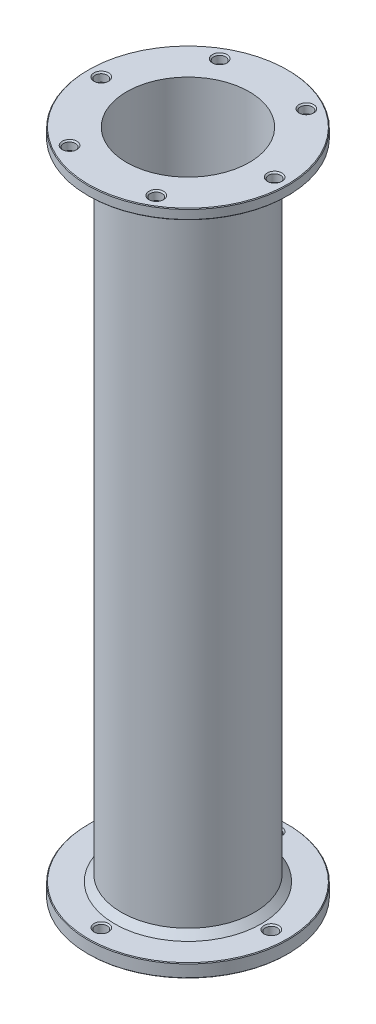
from build123d import *

# Parameters (mm, degrees)
SKIZZE1_R                       = 150
SKIZZE1_R_2                     = 92
SKIZZE1_R_3                     = 9
AUFSATZ_LINEAR_AUSTRAGEN1_DEPTH = 20
SKIZZE2_R                       = 100
SKIZZE2_R_2                     = 92
AUFSATZ_LINEAR_AUSTRAGEN2_DEPTH = 965
SKIZZE3_R                       = 150
SKIZZE3_R_2                     = 92
SKIZZE3_R_3                     = 9
AUFSATZ_LINEAR_AUSTRAGEN3_DEPTH = 15
FASE1_SIZE                      = 10
FASE2_SIZE                      = 1
FASE3_SIZE                      = 2


with BuildPart() as part:
    # Skizze1 → Aufsatz-Linear austragen1 (new body)
    with BuildSketch(Plane(origin=(0, 0, 0), x_dir=(1, 0, 0), z_dir=(0, 1, 0))):
        with Locations(Location((0, 0, 0), (0, 0, 270))):
            Circle(SKIZZE1_R)
        with Locations(Location((0, 0, 0), (0, 0, 270))):
            Circle(SKIZZE1_R_2, mode=Mode.SUBTRACT)
        with Locations(Location((0, 130, 0), (0, 0, 270))):
            Circle(SKIZZE1_R_3, mode=Mode.SUBTRACT)
        with Locations(Location((125, 0, 0), (0, 0, 270))):
            Circle(SKIZZE1_R_3, mode=Mode.SUBTRACT)
        with Locations(Location((-5, -125, 0), (0, 0, 270))):
            Circle(SKIZZE1_R_3, mode=Mode.SUBTRACT)
        with Locations(Location((-130, 5, 0), (0, 0, 270))):
            Circle(SKIZZE1_R_3, mode=Mode.SUBTRACT)
    extrude(amount=AUFSATZ_LINEAR_AUSTRAGEN1_DEPTH)

    # Skizze2 → Aufsatz-Linear austragen2 (add)
    with BuildSketch(Plane(origin=(0, 20, 0), x_dir=(1, 0, 0), z_dir=(0, 1, 0))):
        with Locations(Location((0, 0, 0), (0, 0, 270))):
            Circle(SKIZZE2_R)
        with Locations(Location((0, 0, 0), (0, 0, 270))):
            Circle(SKIZZE2_R_2, mode=Mode.SUBTRACT)
    extrude(amount=AUFSATZ_LINEAR_AUSTRAGEN2_DEPTH)

    # Skizze3 → Aufsatz-Linear austragen3 (add)
    with BuildSketch(Plane(origin=(0, 985, 0), x_dir=(1, 0, 0), z_dir=(0, 1, 0))):
        with Locations(Location((0, 0, 0), (0, 0, 270))):
            Circle(SKIZZE3_R)
        with Locations(Location((0, 0, 0), (0, 0, 270))):
            Circle(SKIZZE3_R_2, mode=Mode.SUBTRACT)
        with Locations(Location((130, 0, 0), (0, 0, 270))):
            Circle(SKIZZE3_R_3, mode=Mode.SUBTRACT)
        with Locations(Location((65, -112.583302492, 0), (0, 0, 270))):
            Circle(SKIZZE3_R_3, mode=Mode.SUBTRACT)
        with Locations(Location((-65, -112.583302492, 0), (0, 0, 270))):
            Circle(SKIZZE3_R_3, mode=Mode.SUBTRACT)
        with Locations(Location((-130, 0, 0), (0, 0, 270))):
            Circle(SKIZZE3_R_3, mode=Mode.SUBTRACT)
        with Locations(Location((-65, 112.583302492, 0), (0, 0, 270))):
            Circle(SKIZZE3_R_3, mode=Mode.SUBTRACT)
        with Locations(Location((65, 112.583302492, 0), (0, 0, 270))):
            Circle(SKIZZE3_R_3, mode=Mode.SUBTRACT)
    extrude(amount=AUFSATZ_LINEAR_AUSTRAGEN3_DEPTH)

    # Fase1
    fase1_edges = [part.edges().sort_by_distance(p)[0] for p in [
        (0, 985, -100),
        (0, 20, -100),
    ]]
    chamfer(fase1_edges, length=FASE1_SIZE)

    # Fase2
    fase2_edges = [part.edges().sort_by_distance(p)[0] for p in [
        (0, 0, -150),
        (0, 1000, -150),
        (0, 985, -150),
        (0, 20, -150),
    ]]
    chamfer(fase2_edges, length=FASE2_SIZE)

    # Fase3
    fase3_edges = [part.edges().sort_by_distance(p)[0] for p in [
        (125, 0, -9),
        (125, 20, -9),
        (-5, 0, 116),
        (-5, 20, 116),
        (-130, 0, -14),
        (-130, 20, -14),
        (130, 985, -9),
        (65, 985, 103.583302492),
        (-65, 985, 103.583302492),
        (-130, 985, -9),
        (-65, 985, -121.583302492),
        (65, 985, -121.583302492),
        (130, 1000, -9),
        (65, 1000, 103.583302492),
        (-65, 1000, 103.583302492),
        (-130, 1000, -9),
        (-65, 1000, -121.583302492),
        (65, 1000, -121.583302492),
        (0, 0, -139),
        (0, 20, -139),
    ]]
    chamfer(fase3_edges, length=FASE3_SIZE)


solid = part.part
